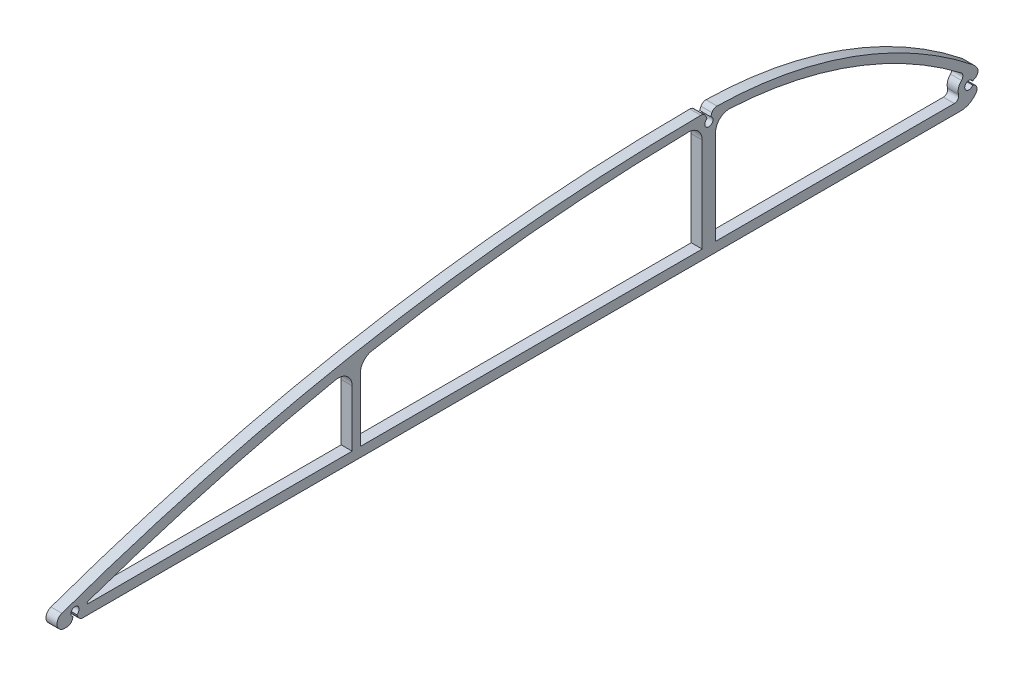
from build123d import *

# Parameters (mm, degrees)
BOSS_EXTRU_1_DEPTH      = 2
CONG_2_R                = 1.35
ESQUISSE4_R             = 0.75
ENL_V_MAT_EXTRU_2_DEPTH = 176.894862906
CONG_5_R                = 1
ENL_V_MAT_EXTRU_3_DEPTH = 4
CONG_3_R                = 2.5
CONG_4_R                = 0.8


with BuildPart() as part:
    # Esquisse2 → Boss.-Extru.1 (new body)
    with BuildSketch(Plane(origin=(0, 0, 0), x_dir=(0, 0, -1), z_dir=(1, 0, 0))):
        with BuildLine():
            Line((0, 0), (170.873171093, 0))
            ThreePointArc((170.873171093, 0), (174.177922559, 2.347343181), (173.049882129, 6.240789861))
            ThreePointArc((173.049882129, 6.240789861), (150.444362328, 18.689979585), (125, 23))
            ThreePointArc((125, 23), (61.450806457, 17.202138822), (0, 0))
        make_face()
    extrude(amount=BOSS_EXTRU_1_DEPTH)

    # Congé2
    cong_2_edges = [part.edges().sort_by_distance(p)[0] for p in [
        (1, 0, 0),
    ]]
    fillet(cong_2_edges, radius=CONG_2_R)

    # Esquisse4 → Enlèv. mat.-Extru.2 (cut, through all)
    with BuildSketch(Plane(origin=(2, 0, 0), x_dir=(0, 0, -1), z_dir=(1, 0, 0))):
        with BuildLine():
            ThreePointArc((125.75, 21.2), (125.632543584, 21.602974706), (125.316963696, 21.87973084))
            Line((125.316963696, 21.87973084), (125, 21.2))
            Line((125, 21.2), (124.683036304, 21.87973084))
            ThreePointArc((124.683036304, 21.87973084), (124.597025294, 20.567456416), (125.75, 21.2))
        make_face()
        with BuildLine():
            Line((125, 21.2), (125.316963696, 21.87973084))
            ThreePointArc((125.316963696, 21.87973084), (125, 21.95), (124.683036304, 21.87973084))
            Line((124.683036304, 21.87973084), (125, 21.2))
        make_face()
        with Locations((172.368958832, 3.328337296)):
            Circle(ESQUISSE4_R)
        with Locations((9.5, 1.731368161)):
            Circle(ESQUISSE4_R)
        with BuildLine():
            Line((125.316963696, 21.87973084), (125.837238378, 22.995463495))
            ThreePointArc((125.837238378, 22.995463495), (125.418625334, 22.998865865), (125, 23))
            ThreePointArc((125, 23), (124.580556422, 22.999749507), (124.161113442, 22.99899803))
            Line((124.161113442, 22.99899803), (124.683036304, 21.87973084))
            ThreePointArc((124.683036304, 21.87973084), (125, 21.95), (125.316963696, 21.87973084))
        make_face()
        with BuildLine():
            Line((125.837238378, 22.995463495), (126.398922974, 24.2))
            Line((126.398922974, 24.2), (123.601077026, 24.2))
            Line((123.601077026, 24.2), (124.161113442, 22.99899803))
            ThreePointArc((124.161113442, 22.99899803), (124.580556422, 22.999749507), (125, 23))
            ThreePointArc((125, 23), (125.418625334, 22.998865865), (125.837238378, 22.995463495))
        make_face()
        with BuildLine():
            ThreePointArc((174.217111681, 2.466529469), (174.369594573, 3.34181388), (174.296772549, 4.227291596))
            Line((174.296772549, 4.227291596), (173.048689672, 3.645300993))
            ThreePointArc((173.048689672, 3.645300993), (173.101180837, 3.490667007), (173.118958832, 3.328337296))
            ThreePointArc((173.118958832, 3.328337296), (173.101180837, 3.166007586), (173.048689672, 3.0113736))
            Line((173.048689672, 3.0113736), (174.217111681, 2.466529469))
        make_face()
        with BuildLine():
            ThreePointArc((173.118958832, 3.328337296), (173.101180837, 3.490667007), (173.048689672, 3.645300993))
            Line((173.048689672, 3.645300993), (172.368958832, 3.328337296))
            Line((172.368958832, 3.328337296), (173.048689672, 3.0113736))
            ThreePointArc((173.048689672, 3.0113736), (173.101180837, 3.166007586), (173.118958832, 3.328337296))
        make_face()
        with BuildLine():
            Line((172.368958832, 3.328337296), (173.048689672, 3.645300993))
            ThreePointArc((173.048689672, 3.645300993), (171.618958832, 3.328337296), (173.048689672, 3.0113736))
            Line((173.048689672, 3.0113736), (172.368958832, 3.328337296))
        make_face()
        with BuildLine():
            Line((175.368958832, 4.727260271), (174.296772549, 4.227291596))
            ThreePointArc((174.296772549, 4.227291596), (174.369594573, 3.34181388), (174.217111681, 2.466529469))
            Line((174.217111681, 2.466529469), (175.368958832, 1.929414322))
            Line((175.368958832, 1.929414322), (175.368958832, 4.727260271))
        make_face()
        with BuildLine():
            ThreePointArc((9.183036304, 1.051637321), (9.5, 0.981368161), (9.816963696, 1.051637321))
            Line((9.816963696, 1.051637321), (9.5, 1.731368161))
            Line((9.5, 1.731368161), (9.183036304, 1.051637321))
        make_face()
        with BuildLine():
            Line((9.5, 1.731368161), (9.816963696, 1.051637321))
            ThreePointArc((9.816963696, 1.051637321), (10.132543584, 1.328393455), (10.25, 1.731368161))
            ThreePointArc((10.25, 1.731368161), (9.097025294, 2.363911745), (9.183036304, 1.051637321))
            Line((9.183036304, 1.051637321), (9.5, 1.731368161))
        make_face()
        with BuildLine():
            Line((8.692649767, 0), (10.307350233, 0))
            Line((10.307350233, 0), (9.816963696, 1.051637321))
            ThreePointArc((9.816963696, 1.051637321), (9.5, 0.981368161), (9.183036304, 1.051637321))
            Line((9.183036304, 1.051637321), (8.692649767, 0))
        make_face()
        Polygon((10.898922974, -1.268631839), (10.307350233, 0), (8.692649767, 0), (8.101077026, -1.268631839), align=None)
    extrude(amount=-ENL_V_MAT_EXTRU_2_DEPTH, mode=Mode.SUBTRACT)

    # Congé5
    cong_5_edges = [part.edges().sort_by_distance(p)[0] for p in [
        (1, 22.99899803, -124.161113442),
        (1, 22.995463495, -125.837238378),
        (1, 4.227291596, -174.296772549),
        (1, 2.466529469, -174.217111681),
        (1, 0, -10.307350233),
        (1, 0, -8.692649767),
    ]]
    fillet(cong_5_edges, radius=CONG_5_R)

    # Esquisse9 → Enlèv. mat.-Extru.3 (cut)
    with BuildSketch(Plane(origin=(0, 0, 0), x_dir=(0, 0, -1), z_dir=(1, 0, 0))):
        with BuildLine():
            Line((126.213985158, 1.761191042), (171.208548293, 1.761191042))
            ThreePointArc((171.208548293, 1.761191042), (170.45940521, 3.723438508), (171.92571116, 5.227292667))
            ThreePointArc((171.92571116, 5.227292667), (150.407492919, 17.120662481), (126.213985158, 21.497892659))
            Line((126.213985158, 21.497892659), (126.213985158, 1.761191042))
        make_face()
        with BuildLine():
            Line((11.749802346, 1.761191042), (60, 1.761191042))
            Line((60, 1.761191042), (60, 15.113262564))
            ThreePointArc((60, 15.113262564), (35.626415593, 9.474190858), (11.71850292, 2.106527851))
            ThreePointArc((11.71850292, 2.106527851), (11.740815112, 1.934463297), (11.749802346, 1.761191042))
        make_face()
        with BuildLine():
            Line((61.5, 1.761191042), (123.786014842, 1.761191042))
            Line((123.786014842, 1.761191042), (123.786014842, 21.497892659))
            ThreePointArc((123.786014842, 21.497892659), (92.506301163, 19.845888558), (61.5, 15.400790857))
            Line((61.5, 15.400790857), (61.5, 1.761191042))
        make_face()
    extrude(amount=ENL_V_MAT_EXTRU_3_DEPTH, mode=Mode.SUBTRACT)

    # Congé3
    cong_3_edges = [part.edges().sort_by_distance(p)[0] for p in [
        (1, 15.113262564, -60),
        (1, 21.497892659, -126.213985158),
        (1, 21.497892659, -123.786014842),
        (1, 15.400790857, -61.5),
    ]]
    fillet(cong_3_edges, radius=CONG_3_R)

    # Congé4
    cong_4_edges = [part.edges().sort_by_distance(p)[0] for p in [
        (1, 5.227292667, -171.92571116),
        (1, 1.761191042, -171.208548293),
    ]]
    fillet(cong_4_edges, radius=CONG_4_R)


solid = part.part
